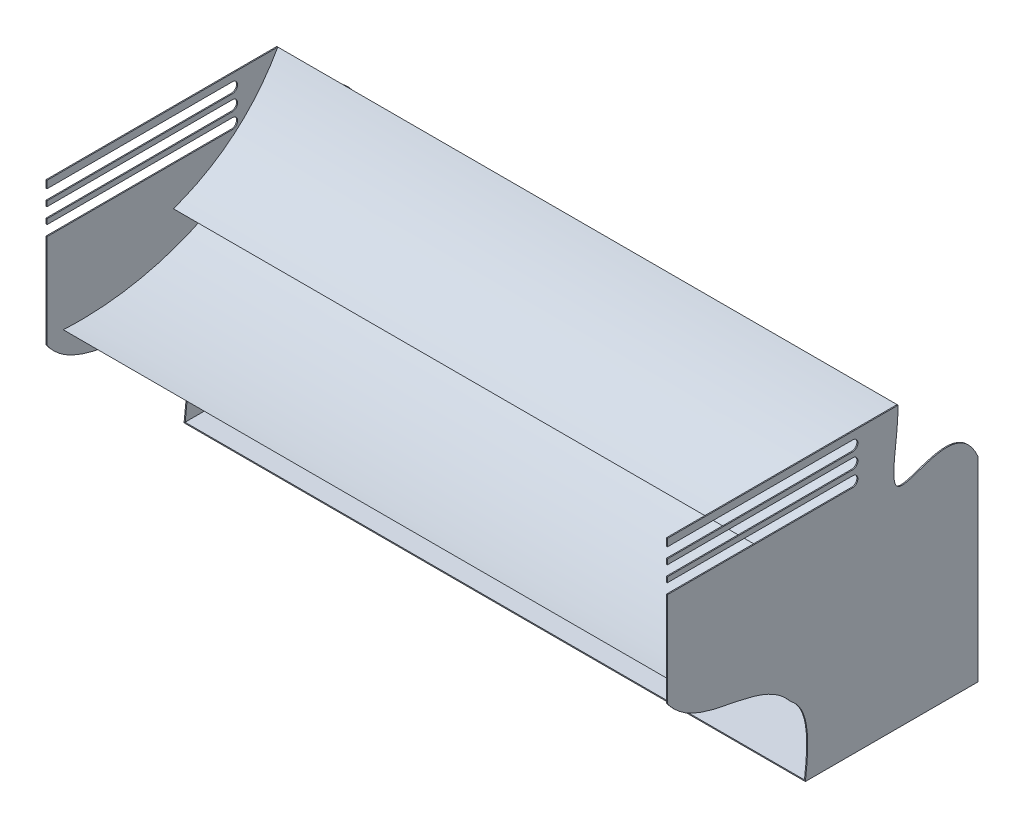
from build123d import *

# Parameters (mm, degrees)
BOSS_EXTRUDE1_START        = 762
BOSS_EXTRUDE1_DEPTH        = 2.54
BOSS_EXTRUDE3_DEPTH        = 759.46
BOSS_EXTRUDE3_DEPTH_BACK   = 762
BOSS_EXTRUDE3_2_DEPTH      = 759.46
BOSS_EXTRUDE3_2_DEPTH_BACK = 762
SKETCH13_W                 = 1524
SKETCH13_H                 = 423.429853573
BOSS_EXTRUDE4_DEPTH        = 2.54
CUT_EXTRUDE1_DEPTH         = 1278.344761778
CUT_EXTRUDE1_DEPTH_BACK    = 1278.344761778
CUT_EXTRUDE2_DEPTH         = 1278.344761778
CUT_EXTRUDE2_DEPTH_BACK    = 1278.344761778
SCALE1_SCALE               = 0.11


with BuildPart() as part:
    # Sketch3 → Boss-Extrude1 (new body)
    with BuildSketch(Plane(origin=(0, 0, 0), x_dir=(0, 0, -1), z_dir=(1, 0, 0)).offset(BOSS_EXTRUDE1_START)):
        with BuildLine():
            Line((338.570146427, 0), (762, 0))
            Line((762, 0), (762, 478.643823899))
            add(Edge.make_bspline(
                [(566.02119263, 685.8), (566.02119263, 609.562833411), (511.018643959, 418.064816879), (711.566045078, 596.214023542), (762, 478.643823899)],
                knots=[0, 0, 0, 0, 0.43337684, 1, 1, 1, 1], degree=3))
            Line((566.02119263, 685.8), (0, 685.8))
            Line((0, 685.8), (0, 216.97447871))
            add(Edge.make_bspline(
                [(0, 216.97447871), (268.153594246, 216.97447871), (370.795901917, 243.07894269), (338.570146427, 0)],
                knots=[0, 0, 0, 0, 1, 1, 1, 1], degree=3))
        make_face()
    extrude(amount=-BOSS_EXTRUDE1_DEPTH)


with BuildPart() as body_2:
    # Mirror1: mirrored copy
    add(part.part.mirror(Plane(origin=(0, 0, 0), x_dir=(0, 0, 1), z_dir=(1, 0, 0))))


with BuildPart() as body_3:
    # Sketch8 → Boss-Extrude3 (new, two sides: drawn at the far end of the back side and taken through both)
    with BuildSketch(Plane(origin=(0, 0, 0), x_dir=(0, 0, -1), z_dir=(1, 0, 0)).offset(-BOSS_EXTRUDE3_DEPTH_BACK)):
        with BuildLine():
            add(Edge.make_bspline(
                [(566.02119263, 685.8), (478.94605907, 530.59259106), (310.041791286, 470.260887435)],
                knots=[0, 0, 0, 1, 1, 1], degree=2))
            add(Edge.make_bspline(
                [(566.02119263, 685.8), (535.192963113, 473.791997419), (310.041791286, 470.260887435)],
                knots=[0, 0, 0, 1, 1, 1], degree=2))
        make_face()
    extrude(amount=BOSS_EXTRUDE3_DEPTH + BOSS_EXTRUDE3_DEPTH_BACK)


with BuildPart() as body_4:
    # Sketch8 → Boss-Extrude3 2 (new, two sides: drawn at the far end of the back side and taken through both)
    with BuildSketch(Plane(origin=(0, 0, 0), x_dir=(0, 0, -1), z_dir=(1, 0, 0)).offset(-BOSS_EXTRUDE3_2_DEPTH_BACK)):
        with BuildLine():
            add(Edge.make_bspline(
                [(493.805357443, 481.17753493), (291.820165627, 335.217986135), (39.854765798, 348.358323747)],
                knots=[0, 0, 0, 1, 1, 1], degree=2))
            add(Edge.make_bspline(
                [(493.805357443, 481.17753493), (323.598432885, 237.863082713), (39.854765798, 348.358323747)],
                knots=[0, 0, 0, 1, 1, 1], degree=2))
        make_face()
    extrude(amount=BOSS_EXTRUDE3_2_DEPTH + BOSS_EXTRUDE3_2_DEPTH_BACK)


with BuildPart() as part_1:
    add(part.part)

    add(body_2.part)  # Boss-Extrude4 merges body 2
    # Sketch13 → Boss-Extrude4 (add)
    with BuildSketch(Plane(origin=(0, 0, 0), x_dir=(1, 0, 0), z_dir=(0, 1, 0))):
        with Locations((0, 550.285073214)):
            Rectangle(SKETCH13_W, SKETCH13_H)
    extrude(amount=BOSS_EXTRUDE4_DEPTH)

    # Sketch16 → Cut-Extrude1 (cut, two sides: drawn at the far end of the back side and taken through both)
    with BuildSketch(Plane(origin=(0, 0, 0), x_dir=(0, 0, -1), z_dir=(1, 0, 0)).offset(-CUT_EXTRUDE1_DEPTH_BACK)):
        with BuildLine():
            Line((0, 667.670249742), (454.687424311, 667.670249742))
            ThreePointArc((454.687424311, 667.670249742), (467.387424311, 654.970249742), (454.687424311, 642.270249742))
            Line((454.687424311, 642.270249742), (0, 642.270249742))
            ThreePointArc((0, 642.270249742), (-12.7, 654.970249742), (0, 667.670249742))
        make_face()
        with BuildLine():
            Line((0, 604.170249742), (454.687424311, 604.170249742))
            ThreePointArc((454.687424311, 604.170249742), (467.387424311, 616.870249742), (454.687424311, 629.570249742))
            Line((454.687424311, 629.570249742), (0, 629.570249742))
            ThreePointArc((0, 629.570249742), (-12.7, 616.870249742), (0, 604.170249742))
        make_face()
        with BuildLine():
            Line((0, 566.070249742), (454.687424311, 566.070249742))
            ThreePointArc((454.687424311, 566.070249742), (467.387424311, 578.770249742), (454.687424311, 591.470249742))
            Line((454.687424311, 591.470249742), (0, 591.470249742))
            ThreePointArc((0, 591.470249742), (-12.7, 578.770249742), (0, 566.070249742))
        make_face()
    extrude(amount=CUT_EXTRUDE1_DEPTH + CUT_EXTRUDE1_DEPTH_BACK, mode=Mode.SUBTRACT)

    # Sketch17 → Cut-Extrude2 (cut, two sides: drawn at the far end of the back side and taken through both)
    with BuildSketch(Plane(origin=(0, 0, 0), x_dir=(0, 0, -1), z_dir=(1, 0, 0)).offset(-CUT_EXTRUDE2_DEPTH_BACK)):
        with BuildLine():
            Line((0, 334.71225841), (0, 103.643051311))
            Line((0, 103.643051311), (302.999558796, 187.654799067))
            add(Edge.make_bspline(
                [(302.999558796, 187.654799067), (225.21849282, 285.739628908), (76.800772912, 227.85117527), (0, 334.71225841)],
                knots=[0, 0, 0, 0, 1, 1, 1, 1], degree=3))
        make_face()
    extrude(amount=CUT_EXTRUDE2_DEPTH + CUT_EXTRUDE2_DEPTH_BACK, mode=Mode.SUBTRACT)

    # Combine1: union body 4, body 3
    add(body_4.part)
    add(body_3.part)


with BuildPart() as part_2:
    # Scale1: scaled about (0, 0, 0)
    add(part_1.part.scale(SCALE1_SCALE))


solid = part_2.part
